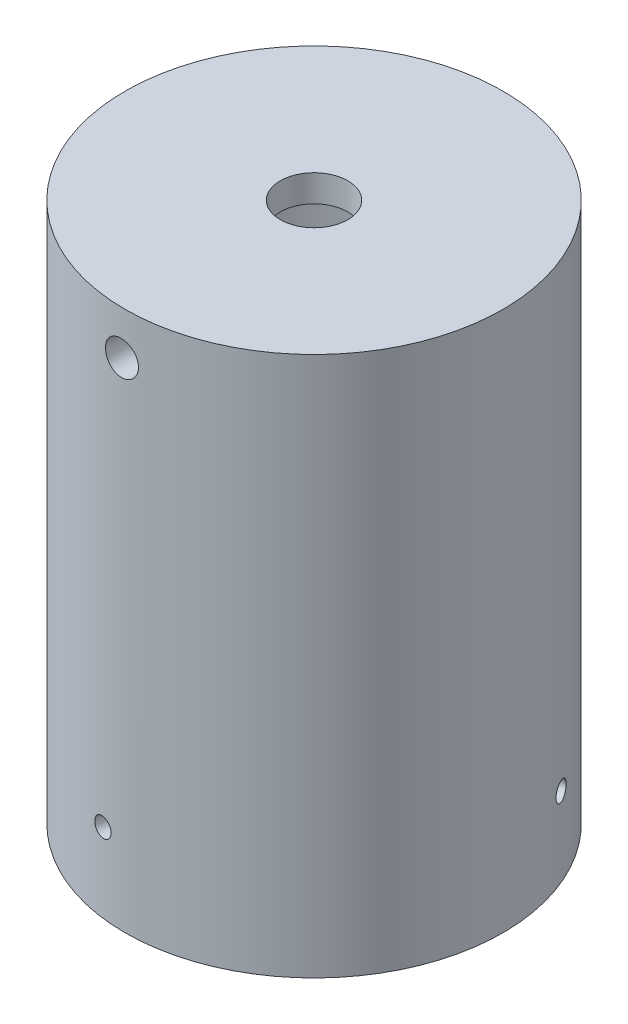
from build123d import *

# Parameters (mm, degrees)
SKETCH1_R                     = 17.78
BOSS_EXTRUDE1_DEPTH           = 50.8
SHELL1_T                      = -2.54
SKETCH2_R                     = 3.175
CUT_EXTRUDE1_DEPTH            = 55.417684625
TAP_DRILL_FOR_0_80_TAP1_D     = 3.175
TAP_DRILL_FOR_0_80_TAP1_DEPTH = 6.35
TAP_DRILL_FOR_0_80_TAP1_TIP   = 1.332070664
CIRPATTERN1_COUNT             = 3


with BuildPart() as part:
    # Sketch1 → Boss-Extrude1 (new body)
    with BuildSketch(Plane(origin=(0, 0, 0), x_dir=(1, 0, 0), z_dir=(0, 1, 0))):
        with Locations(Location((0, 0, 0), (0, 0, 270))):
            Circle(SKETCH1_R)
    extrude(amount=BOSS_EXTRUDE1_DEPTH)

    # Shell1
    shell1_openings = [part.faces().sort_by_distance(p)[0] for p in [
        (0, 0, 0),
    ]]
    offset(amount=SHELL1_T, openings=shell1_openings, kind=Kind.INTERSECTION)

    # Sketch2 → Cut-Extrude1 (cut, through all)
    with BuildSketch(Plane.XZ.offset(-48.26)):
        with Locations(Location((0, 0, 0), (0, 0, 270))):
            Circle(SKETCH2_R)
    extrude(amount=-CUT_EXTRUDE1_DEPTH, mode=Mode.SUBTRACT)

    # Tap Drill for #0-80 Tap1
    with Locations(Plane(origin=(-0.363072826, 46.659447592, 17.776292587), x_dir=(0.999791484059, 0, 0.0204202939), z_dir=(-0.0204202939, 0, 0.999791484059))):
        with Locations((0, 0)):
            Hole(TAP_DRILL_FOR_0_80_TAP1_D / 2, depth=TAP_DRILL_FOR_0_80_TAP1_DEPTH)
            with Locations((0, 0, -(TAP_DRILL_FOR_0_80_TAP1_DEPTH + TAP_DRILL_FOR_0_80_TAP1_TIP / 2))):  # 100° drill point
                Cone(0, TAP_DRILL_FOR_0_80_TAP1_D / 2, TAP_DRILL_FOR_0_80_TAP1_TIP, mode=Mode.SUBTRACT)

    # Sketch8 → Tap Drill for #2-56 Tap1 (revolve, cut)
    with BuildSketch(Plane(origin=(-2.247699143, 7.424974445, 17.637353786), x_dir=(0.9919771533037619, 0, 0.1264172746240199), z_dir=(0, 1, 0))):
        Polygon((0, 0), (0, 9.635959572), (0.889, 8.89), (0.889, 0), align=None)
    tap_drill_for_2_56_tap1 = revolve(axis=Axis((-3.050448837, 7.424974445, 23.936408709), (0.1264172746240199, 0, -0.9919771533037619)), mode=Mode.SUBTRACT)

    # CirPattern1: Tap Drill for #2-56 Tap1 ×3 about axis
    cirpattern1_axis = Axis((0, 50.8, 0), (0, -1, 0))
    for i in range(1, CIRPATTERN1_COUNT):
        add(tap_drill_for_2_56_tap1.rotate(cirpattern1_axis, i * 360 / CIRPATTERN1_COUNT), mode=Mode.SUBTRACT)


solid = part.part
